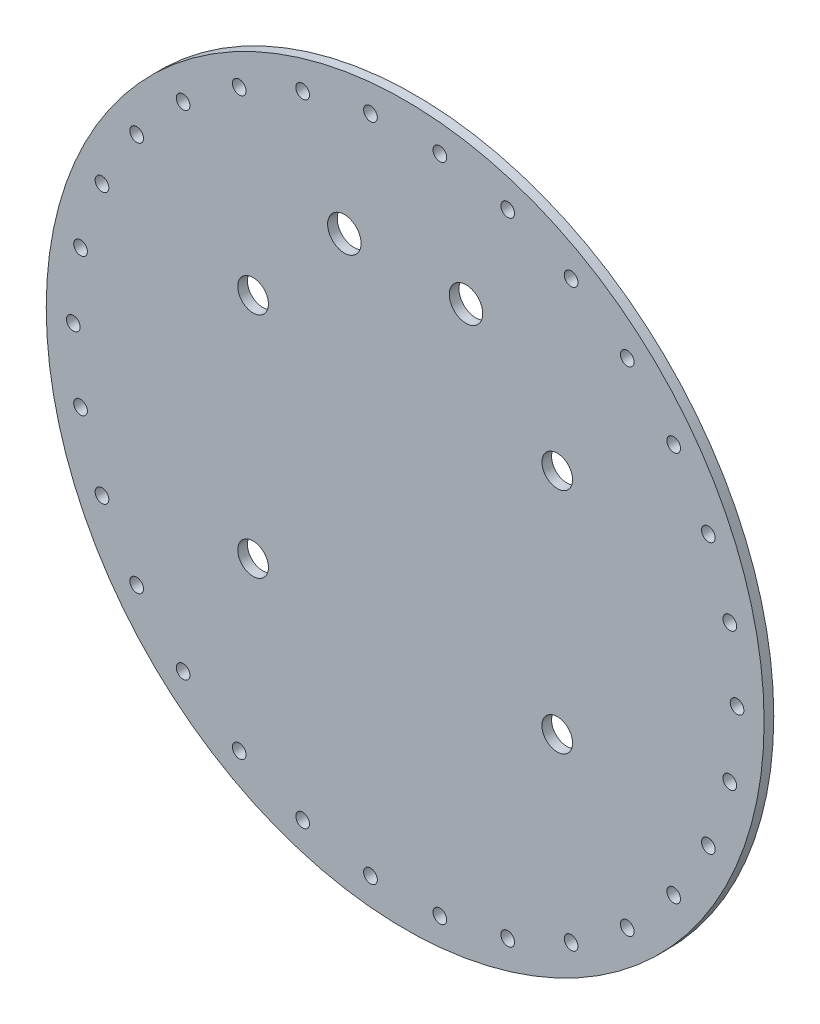
from build123d import *

# Parameters (mm, degrees)
SKETCH1_R              = 2.2479
BOSS_EXTRUDE1_DEPTH    = 3.175
STAND_OFF_THRU_HOLES_D = 10.0838
SENSOR_THRU_HOLES_D    = 11


with BuildPart() as part:
    # Sketch1 → Boss-Extrude1 (new body)
    with BuildSketch(Plane.XY):
        with BuildLine():
            ThreePointArc((115.886477974, -22.233403312), (0, 118), (-115.886477974, -22.233403312))
            ThreePointArc((-115.886477974, -22.233403312), (0, -118), (115.886477974, -22.233403312))
        make_face()
        with Locations((109.1, 0)):
            Circle(SKETCH1_R, mode=Mode.SUBTRACT)
        with Locations((106.71590324, -22.683165468)):
            Circle(SKETCH1_R, mode=Mode.SUBTRACT)
        with Locations((99.667809429, -44.37496776)):
            Circle(SKETCH1_R, mode=Mode.SUBTRACT)
        with Locations((88.263754086, -64.127371025)):
            Circle(SKETCH1_R, mode=Mode.SUBTRACT)
        with Locations((73.002149154, -81.07710046)):
            Circle(SKETCH1_R, mode=Mode.SUBTRACT)
        with Locations((54.55, -94.483371553)):
            Circle(SKETCH1_R, mode=Mode.SUBTRACT)
        with Locations((33.713754086, -103.760265928)):
            Circle(SKETCH1_R, mode=Mode.SUBTRACT)
        with Locations((11.404055343, -108.502338785)):
            Circle(SKETCH1_R, mode=Mode.SUBTRACT)
        with Locations((-11.404055343, -108.502338785)):
            Circle(SKETCH1_R, mode=Mode.SUBTRACT)
        with Locations((-33.713754086, -103.760265928)):
            Circle(SKETCH1_R, mode=Mode.SUBTRACT)
        with Locations((-54.55, -94.483371553)):
            Circle(SKETCH1_R, mode=Mode.SUBTRACT)
        with Locations((-73.002149154, -81.07710046)):
            Circle(SKETCH1_R, mode=Mode.SUBTRACT)
        with Locations((-88.263754086, -64.127371025)):
            Circle(SKETCH1_R, mode=Mode.SUBTRACT)
        with Locations((-99.667809429, -44.37496776)):
            Circle(SKETCH1_R, mode=Mode.SUBTRACT)
        with Locations((-106.71590324, -22.683165468)):
            Circle(SKETCH1_R, mode=Mode.SUBTRACT)
        with Locations((-109.1, 0)):
            Circle(SKETCH1_R, mode=Mode.SUBTRACT)
        with Locations((-106.71590324, 22.683165468)):
            Circle(SKETCH1_R, mode=Mode.SUBTRACT)
        with Locations((-99.667809429, 44.37496776)):
            Circle(SKETCH1_R, mode=Mode.SUBTRACT)
        with Locations((-88.263754086, 64.127371025)):
            Circle(SKETCH1_R, mode=Mode.SUBTRACT)
        with Locations((-73.002149154, 81.07710046)):
            Circle(SKETCH1_R, mode=Mode.SUBTRACT)
        with Locations((-54.55, 94.483371553)):
            Circle(SKETCH1_R, mode=Mode.SUBTRACT)
        with Locations((-33.713754086, 103.760265928)):
            Circle(SKETCH1_R, mode=Mode.SUBTRACT)
        with Locations((-11.404055343, 108.502338785)):
            Circle(SKETCH1_R, mode=Mode.SUBTRACT)
        with Locations((11.404055343, 108.502338785)):
            Circle(SKETCH1_R, mode=Mode.SUBTRACT)
        with Locations((33.713754086, 103.760265928)):
            Circle(SKETCH1_R, mode=Mode.SUBTRACT)
        with Locations((54.55, 94.483371553)):
            Circle(SKETCH1_R, mode=Mode.SUBTRACT)
        with Locations((73.002149154, 81.07710046)):
            Circle(SKETCH1_R, mode=Mode.SUBTRACT)
        with Locations((88.263754086, 64.127371025)):
            Circle(SKETCH1_R, mode=Mode.SUBTRACT)
        with Locations((99.667809429, 44.37496776)):
            Circle(SKETCH1_R, mode=Mode.SUBTRACT)
        with Locations((106.71590324, 22.683165468)):
            Circle(SKETCH1_R, mode=Mode.SUBTRACT)
    extrude(amount=BOSS_EXTRUDE1_DEPTH)

    # Stand-off Thru Holes (through all)
    with Locations(Plane(origin=(0, 0, 0), x_dir=(-1, 0, 0), z_dir=(0, 0, -1))):
        with Locations((50, -37.5), (50, 37.5), (-50, 37.5), (-50, -37.5)):
            Hole(STAND_OFF_THRU_HOLES_D / 2)

    # Sensor Thru Holes (through all)
    with Locations(Plane(origin=(20, 70, 0), x_dir=(-1, 0, 0), z_dir=(0, 0, -1))):
        with Locations((0, 0), (40, 0)):
            Hole(SENSOR_THRU_HOLES_D / 2)


solid = part.part
